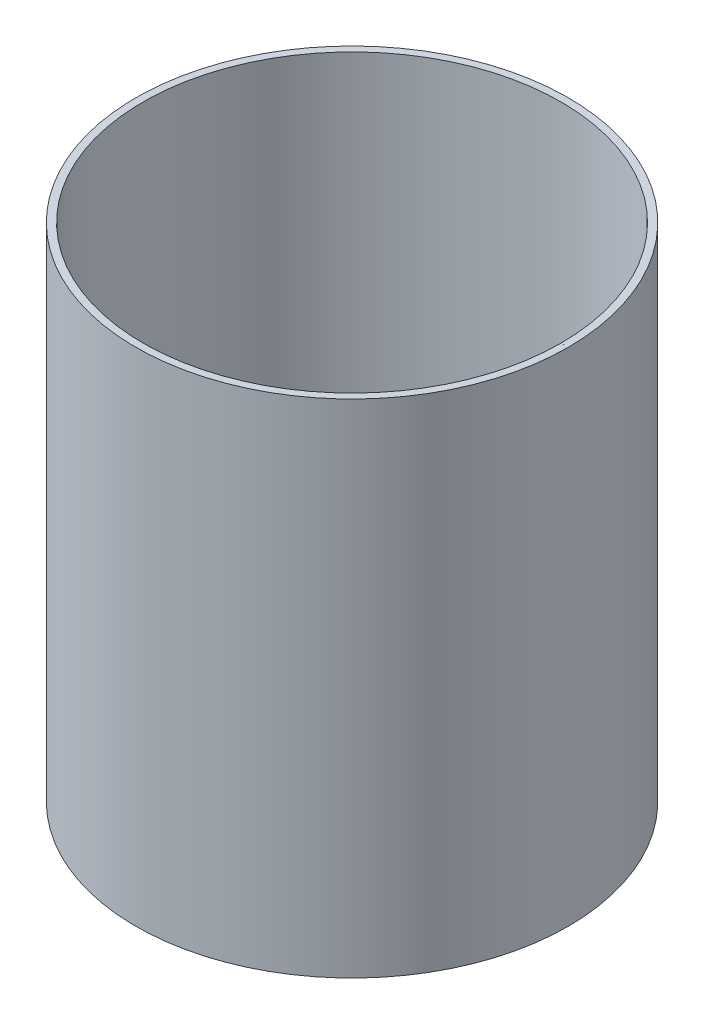
from build123d import *

# Parameters (mm, degrees)
SKETCH1_W      = 26
SKETCH1_H      = 1800
REVOLVE1_ANGLE = 359.99


with BuildPart() as part:
    # Sketch1 → Revolve1 (revolve)
    with BuildSketch(Plane.XY):
        with Locations((763, 0)):
            Rectangle(SKETCH1_W, SKETCH1_H)
    revolve(axis=Axis((0, 0, 0), (0, 1, 0)), revolution_arc=REVOLVE1_ANGLE)


solid = part.part
